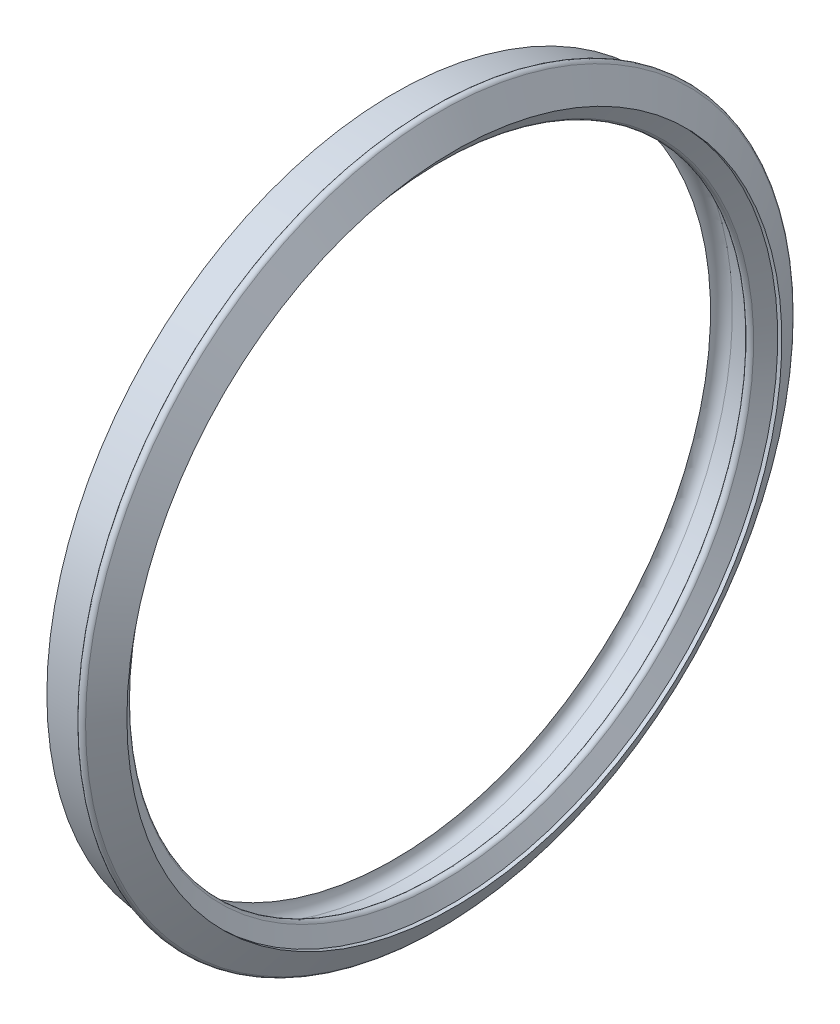
from build123d import *


with BuildPart() as part:
    # Эскиз1 → Повернуть1 (revolve)
    with BuildSketch(Plane.XY, mode=Mode.PRIVATE) as revolve_1_sk:
        with BuildLine():
            Line((0, 15.9), (1.553589838, 15.9))
            Line((1.553589838, 15.9), (1.726794919, 16.2))
            ThreePointArc((1.726794919, 16.2), (1.9, 16.3), (2.073205081, 16.2))
            Line((2.073205081, 16.2), (2.766025404, 15))
            Line((2.766025404, 15), (2.577350269, 15))
            Line((2.577350269, 15), (2.173205081, 14.3))
            ThreePointArc((2.173205081, 14.3), (2, 14.2), (1.826794919, 14.3))
            Line((1.826794919, 14.3), (1.422649731, 15))
            Line((1.422649731, 15), (0, 15))
            Line((0, 15), (0, 15.9))
        make_face()
    revolve(revolve_1_sk.sketch.rotate(Axis((0, 0, 0), (1, 0, 0)), 90), axis=Axis((0, 0, 0), (1, 0, 0)))

    # Эскиз2 → Повернуть2 (revolve)
    with BuildSketch(Plane.XY, mode=Mode.PRIVATE) as revolve_2_sk:
        with BuildLine():
            Line((0, 14.5), (0, 15))
            Line((0, 15), (0.5, 15))
            ThreePointArc((0.5, 15), (0.146446609, 14.853553391), (0, 14.5))
        make_face()
    revolve(revolve_2_sk.sketch.rotate(Axis((0, 0, 0), (1, 0, 0)), 90), axis=Axis((0, 0, 0), (1, 0, 0)))


solid = part.part
